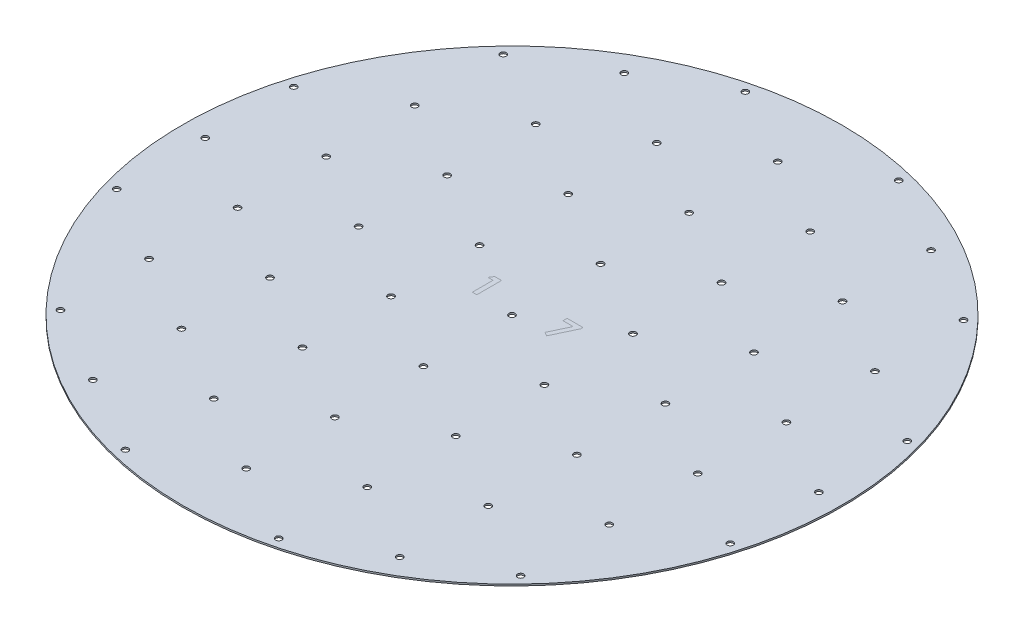
from build123d import *

# Parameters (mm, degrees)
SKETCH2_R                = 40
BOSS_EXTRUDE1_DEPTH      = 0.2
SKETCH4_R                = 0.375
CUT_EXTRUDE2_DEPTH       = 0.2
LPATTERN1_COUNT          = 4
LPATTERN1_PITCH          = 10.75
LPATTERN1_COUNT_DIR2     = 3
LPATTERN1_PITCH_DIR2     = 18.619546181
MIRROR1_COPY_1_SKETCH_R  = 0.375
MIRROR1_COPY_1_DEPTH     = 0.2
MIRROR1_COPY_2_SKETCH_R  = 0.375
MIRROR1_COPY_2_DEPTH     = 0.2
MIRROR1_COPY_3_SKETCH_R  = 0.375
MIRROR1_COPY_3_DEPTH     = 0.2
MIRROR1_COPY_4_SKETCH_R  = 0.375
MIRROR1_COPY_4_DEPTH     = 0.2
MIRROR1_COPY_5_SKETCH_R  = 0.375
MIRROR1_COPY_5_DEPTH     = 0.2
MIRROR1_COPY_6_SKETCH_R  = 0.375
MIRROR1_COPY_6_DEPTH     = 0.2
MIRROR1_COPY_7_SKETCH_R  = 0.375
MIRROR1_COPY_7_DEPTH     = 0.2
MIRROR1_COPY_8_SKETCH_R  = 0.375
MIRROR1_COPY_8_DEPTH     = 0.2
MIRROR1_COPY_9_SKETCH_R  = 0.375
MIRROR1_COPY_9_DEPTH     = 0.2
MIRROR1_COPY_10_SKETCH_R = 0.375
MIRROR1_COPY_10_DEPTH    = 0.2
MIRROR1_COPY_11_SKETCH_R = 0.375
MIRROR1_COPY_11_DEPTH    = 0.2
MIRROR1_COPY_12_SKETCH_R = 0.375
MIRROR1_COPY_12_DEPTH    = 0.2
MIRROR2_COPY_1_SKETCH_R  = 0.375
MIRROR2_COPY_1_DEPTH     = 0.2
MIRROR2_COPY_2_SKETCH_R  = 0.375
MIRROR2_COPY_2_DEPTH     = 0.2
MIRROR2_COPY_3_SKETCH_R  = 0.375
MIRROR2_COPY_3_DEPTH     = 0.2
MIRROR2_COPY_4_SKETCH_R  = 0.375
MIRROR2_COPY_4_DEPTH     = 0.2
MIRROR2_COPY_5_SKETCH_R  = 0.375
MIRROR2_COPY_5_DEPTH     = 0.2
MIRROR2_COPY_6_SKETCH_R  = 0.375
MIRROR2_COPY_6_DEPTH     = 0.2
MIRROR2_COPY_7_SKETCH_R  = 0.375
MIRROR2_COPY_7_DEPTH     = 0.2
MIRROR2_COPY_8_SKETCH_R  = 0.375
MIRROR2_COPY_8_DEPTH     = 0.2
MIRROR2_COPY_9_SKETCH_R  = 0.375
MIRROR2_COPY_9_DEPTH     = 0.2
MIRROR2_COPY_10_SKETCH_R = 0.375
MIRROR2_COPY_10_DEPTH    = 0.2
MIRROR2_COPY_11_SKETCH_R = 0.375
MIRROR2_COPY_11_DEPTH    = 0.2
MIRROR2_COPY_12_SKETCH_R = 0.375
MIRROR2_COPY_12_DEPTH    = 0.2
MIRROR2_COPY_13_SKETCH_R = 0.375
MIRROR2_COPY_13_DEPTH    = 0.2
MIRROR2_COPY_14_SKETCH_R = 0.375
MIRROR2_COPY_14_DEPTH    = 0.2
MIRROR2_COPY_15_SKETCH_R = 0.375
MIRROR2_COPY_15_DEPTH    = 0.2
MIRROR2_COPY_16_SKETCH_R = 0.375
MIRROR2_COPY_16_DEPTH    = 0.2
MIRROR2_COPY_17_SKETCH_R = 0.375
MIRROR2_COPY_17_DEPTH    = 0.2
MIRROR2_COPY_18_SKETCH_R = 0.375
MIRROR2_COPY_18_DEPTH    = 0.2
MIRROR2_COPY_19_SKETCH_R = 0.375
MIRROR2_COPY_19_DEPTH    = 0.2
MIRROR2_COPY_20_SKETCH_R = 0.375
MIRROR2_COPY_20_DEPTH    = 0.2
MIRROR2_COPY_21_SKETCH_R = 0.375
MIRROR2_COPY_21_DEPTH    = 0.2
MIRROR2_COPY_22_SKETCH_R = 0.375
MIRROR2_COPY_22_DEPTH    = 0.2
MIRROR2_COPY_23_SKETCH_R = 0.375
MIRROR2_COPY_23_DEPTH    = 0.2
MIRROR2_COPY_24_SKETCH_R = 0.375
MIRROR2_COPY_24_DEPTH    = 0.2
MIRROR2_COPY_25_SKETCH_R = 0.375
MIRROR2_COPY_25_DEPTH    = 0.2
SPLIT1_SURFACE_1_1_BACK  = 114.137
SPLIT1_SURFACE_1_1_DEPTH = 228.274
SPLIT1_SURFACE_1_2_BACK  = 114.137
SPLIT1_SURFACE_1_2_DEPTH = 228.274
SPLIT1_SURFACE_2_3_BACK  = 114.137
SPLIT1_SURFACE_2_3_DEPTH = 228.274
SPLIT1_SURFACE_2_4_BACK  = 114.137
SPLIT1_SURFACE_2_4_DEPTH = 228.274


with BuildPart() as part:
    # Sketch2 → Boss-Extrude1 (new body)
    with BuildSketch(Plane(origin=(0, 0, 0), x_dir=(1, 0, 0), z_dir=(0, 1, 0))):
        Circle(SKETCH2_R)
    extrude(amount=BOSS_EXTRUDE1_DEPTH)

    # Sketch4 → Cut-Extrude2 (cut)
    with BuildSketch(Plane(origin=(0, 0.2, 0), x_dir=(1, 0, 0), z_dir=(0, 1, 0))):
        with Locations((9.309773091, 5.375)):
            Circle(SKETCH4_R)
        Circle(SKETCH4_R)
    cut_extrude2 = extrude(amount=-CUT_EXTRUDE2_DEPTH, mode=Mode.SUBTRACT)

    # LPattern1: Cut-Extrude2 4 × 3
    with Locations(*[(j * LPATTERN1_PITCH_DIR2, 0, -i * LPATTERN1_PITCH) for i in range(LPATTERN1_COUNT) for j in range(LPATTERN1_COUNT_DIR2) if (i, j) != (0, 0)]):
        add(cut_extrude2, mode=Mode.SUBTRACT)

    # Mirror1 copy 1 sketch → Mirror1 copy 1 (cut)
    with BuildSketch(Plane(origin=(-18.619546181, 0.2, 0), x_dir=(-1, 0, 0), z_dir=(0, 1, 0))):
        with Locations((9.309773091, -5.375)):
            Circle(MIRROR1_COPY_1_SKETCH_R)
        Circle(MIRROR1_COPY_1_SKETCH_R)
    extrude(amount=-MIRROR1_COPY_1_DEPTH, mode=Mode.SUBTRACT)

    # Mirror1 copy 2 sketch → Mirror1 copy 2 (cut)
    with BuildSketch(Plane(origin=(-37.239092363, 0.2, 0), x_dir=(-1, 0, 0), z_dir=(0, 1, 0))):
        with Locations((9.309773091, -5.375)):
            Circle(MIRROR1_COPY_2_SKETCH_R)
        Circle(MIRROR1_COPY_2_SKETCH_R)
    extrude(amount=-MIRROR1_COPY_2_DEPTH, mode=Mode.SUBTRACT)

    # Mirror1 copy 3 sketch → Mirror1 copy 3 (cut)
    with BuildSketch(Plane(origin=(0, 0.2, -10.75), x_dir=(-1, 0, 0), z_dir=(0, 1, 0))):
        with Locations((9.309773091, -5.375)):
            Circle(MIRROR1_COPY_3_SKETCH_R)
        Circle(MIRROR1_COPY_3_SKETCH_R)
    extrude(amount=-MIRROR1_COPY_3_DEPTH, mode=Mode.SUBTRACT)

    # Mirror1 copy 4 sketch → Mirror1 copy 4 (cut)
    with BuildSketch(Plane(origin=(-18.619546181, 0.2, -10.75), x_dir=(-1, 0, 0), z_dir=(0, 1, 0))):
        with Locations((9.309773091, -5.375)):
            Circle(MIRROR1_COPY_4_SKETCH_R)
        Circle(MIRROR1_COPY_4_SKETCH_R)
    extrude(amount=-MIRROR1_COPY_4_DEPTH, mode=Mode.SUBTRACT)

    # Mirror1 copy 5 sketch → Mirror1 copy 5 (cut)
    with BuildSketch(Plane(origin=(-37.239092363, 0.2, -10.75), x_dir=(-1, 0, 0), z_dir=(0, 1, 0))):
        with Locations((9.309773091, -5.375)):
            Circle(MIRROR1_COPY_5_SKETCH_R)
        Circle(MIRROR1_COPY_5_SKETCH_R)
    extrude(amount=-MIRROR1_COPY_5_DEPTH, mode=Mode.SUBTRACT)

    # Mirror1 copy 6 sketch → Mirror1 copy 6 (cut)
    with BuildSketch(Plane(origin=(0, 0.2, -21.5), x_dir=(-1, 0, 0), z_dir=(0, 1, 0))):
        with Locations((9.309773091, -5.375)):
            Circle(MIRROR1_COPY_6_SKETCH_R)
        Circle(MIRROR1_COPY_6_SKETCH_R)
    extrude(amount=-MIRROR1_COPY_6_DEPTH, mode=Mode.SUBTRACT)

    # Mirror1 copy 7 sketch → Mirror1 copy 7 (cut)
    with BuildSketch(Plane(origin=(-18.619546181, 0.2, -21.5), x_dir=(-1, 0, 0), z_dir=(0, 1, 0))):
        with Locations((9.309773091, -5.375)):
            Circle(MIRROR1_COPY_7_SKETCH_R)
        Circle(MIRROR1_COPY_7_SKETCH_R)
    extrude(amount=-MIRROR1_COPY_7_DEPTH, mode=Mode.SUBTRACT)

    # Mirror1 copy 8 sketch → Mirror1 copy 8 (cut)
    with BuildSketch(Plane(origin=(-37.239092363, 0.2, -21.5), x_dir=(-1, 0, 0), z_dir=(0, 1, 0))):
        with Locations((9.309773091, -5.375)):
            Circle(MIRROR1_COPY_8_SKETCH_R)
        Circle(MIRROR1_COPY_8_SKETCH_R)
    extrude(amount=-MIRROR1_COPY_8_DEPTH, mode=Mode.SUBTRACT)

    # Mirror1 copy 9 sketch → Mirror1 copy 9 (cut)
    with BuildSketch(Plane(origin=(0, 0.2, -32.25), x_dir=(-1, 0, 0), z_dir=(0, 1, 0))):
        with Locations((9.309773091, -5.375)):
            Circle(MIRROR1_COPY_9_SKETCH_R)
        Circle(MIRROR1_COPY_9_SKETCH_R)
    extrude(amount=-MIRROR1_COPY_9_DEPTH, mode=Mode.SUBTRACT)

    # Mirror1 copy 10 sketch → Mirror1 copy 10 (cut)
    with BuildSketch(Plane(origin=(-18.619546181, 0.2, -32.25), x_dir=(-1, 0, 0), z_dir=(0, 1, 0))):
        with Locations((9.309773091, -5.375)):
            Circle(MIRROR1_COPY_10_SKETCH_R)
        Circle(MIRROR1_COPY_10_SKETCH_R)
    extrude(amount=-MIRROR1_COPY_10_DEPTH, mode=Mode.SUBTRACT)

    # Mirror1 copy 11 sketch → Mirror1 copy 11 (cut)
    with BuildSketch(Plane(origin=(-37.239092363, 0.2, -32.25), x_dir=(-1, 0, 0), z_dir=(0, 1, 0))):
        with Locations((9.309773091, -5.375)):
            Circle(MIRROR1_COPY_11_SKETCH_R)
        Circle(MIRROR1_COPY_11_SKETCH_R)
    extrude(amount=-MIRROR1_COPY_11_DEPTH, mode=Mode.SUBTRACT)

    # Mirror1 copy 12 sketch → Mirror1 copy 12 (cut)
    with BuildSketch(Plane(origin=(0, 0.2, 0), x_dir=(-1, 0, 0), z_dir=(0, 1, 0))):
        with Locations((9.309773091, -5.375)):
            Circle(MIRROR1_COPY_12_SKETCH_R)
        Circle(MIRROR1_COPY_12_SKETCH_R)
    extrude(amount=-MIRROR1_COPY_12_DEPTH, mode=Mode.SUBTRACT)

    # Mirror2 copy 1 sketch → Mirror2 copy 1 (cut)
    with BuildSketch(Plane(origin=(18.619546181, 0.2, 0), x_dir=(1, 0, 0), z_dir=(0, 1, 0))):
        with Locations((9.309773091, -5.375)):
            Circle(MIRROR2_COPY_1_SKETCH_R)
        Circle(MIRROR2_COPY_1_SKETCH_R)
    extrude(amount=-MIRROR2_COPY_1_DEPTH, mode=Mode.SUBTRACT)

    # Mirror2 copy 2 sketch → Mirror2 copy 2 (cut)
    with BuildSketch(Plane(origin=(37.239092363, 0.2, 0), x_dir=(1, 0, 0), z_dir=(0, 1, 0))):
        with Locations((9.309773091, -5.375)):
            Circle(MIRROR2_COPY_2_SKETCH_R)
        Circle(MIRROR2_COPY_2_SKETCH_R)
    extrude(amount=-MIRROR2_COPY_2_DEPTH, mode=Mode.SUBTRACT)

    # Mirror2 copy 3 sketch → Mirror2 copy 3 (cut)
    with BuildSketch(Plane(origin=(0, 0.2, 10.75), x_dir=(1, 0, 0), z_dir=(0, 1, 0))):
        with Locations((9.309773091, -5.375)):
            Circle(MIRROR2_COPY_3_SKETCH_R)
        Circle(MIRROR2_COPY_3_SKETCH_R)
    extrude(amount=-MIRROR2_COPY_3_DEPTH, mode=Mode.SUBTRACT)

    # Mirror2 copy 4 sketch → Mirror2 copy 4 (cut)
    with BuildSketch(Plane(origin=(18.619546181, 0.2, 10.75), x_dir=(1, 0, 0), z_dir=(0, 1, 0))):
        with Locations((9.309773091, -5.375)):
            Circle(MIRROR2_COPY_4_SKETCH_R)
        Circle(MIRROR2_COPY_4_SKETCH_R)
    extrude(amount=-MIRROR2_COPY_4_DEPTH, mode=Mode.SUBTRACT)

    # Mirror2 copy 5 sketch → Mirror2 copy 5 (cut)
    with BuildSketch(Plane(origin=(37.239092363, 0.2, 10.75), x_dir=(1, 0, 0), z_dir=(0, 1, 0))):
        with Locations((9.309773091, -5.375)):
            Circle(MIRROR2_COPY_5_SKETCH_R)
        Circle(MIRROR2_COPY_5_SKETCH_R)
    extrude(amount=-MIRROR2_COPY_5_DEPTH, mode=Mode.SUBTRACT)

    # Mirror2 copy 6 sketch → Mirror2 copy 6 (cut)
    with BuildSketch(Plane(origin=(0, 0.2, 21.5), x_dir=(1, 0, 0), z_dir=(0, 1, 0))):
        with Locations((9.309773091, -5.375)):
            Circle(MIRROR2_COPY_6_SKETCH_R)
        Circle(MIRROR2_COPY_6_SKETCH_R)
    extrude(amount=-MIRROR2_COPY_6_DEPTH, mode=Mode.SUBTRACT)

    # Mirror2 copy 7 sketch → Mirror2 copy 7 (cut)
    with BuildSketch(Plane(origin=(18.619546181, 0.2, 21.5), x_dir=(1, 0, 0), z_dir=(0, 1, 0))):
        with Locations((9.309773091, -5.375)):
            Circle(MIRROR2_COPY_7_SKETCH_R)
        Circle(MIRROR2_COPY_7_SKETCH_R)
    extrude(amount=-MIRROR2_COPY_7_DEPTH, mode=Mode.SUBTRACT)

    # Mirror2 copy 8 sketch → Mirror2 copy 8 (cut)
    with BuildSketch(Plane(origin=(37.239092363, 0.2, 21.5), x_dir=(1, 0, 0), z_dir=(0, 1, 0))):
        with Locations((9.309773091, -5.375)):
            Circle(MIRROR2_COPY_8_SKETCH_R)
        Circle(MIRROR2_COPY_8_SKETCH_R)
    extrude(amount=-MIRROR2_COPY_8_DEPTH, mode=Mode.SUBTRACT)

    # Mirror2 copy 9 sketch → Mirror2 copy 9 (cut)
    with BuildSketch(Plane(origin=(0, 0.2, 32.25), x_dir=(1, 0, 0), z_dir=(0, 1, 0))):
        with Locations((9.309773091, -5.375)):
            Circle(MIRROR2_COPY_9_SKETCH_R)
        Circle(MIRROR2_COPY_9_SKETCH_R)
    extrude(amount=-MIRROR2_COPY_9_DEPTH, mode=Mode.SUBTRACT)

    # Mirror2 copy 10 sketch → Mirror2 copy 10 (cut)
    with BuildSketch(Plane(origin=(18.619546181, 0.2, 32.25), x_dir=(1, 0, 0), z_dir=(0, 1, 0))):
        with Locations((9.309773091, -5.375)):
            Circle(MIRROR2_COPY_10_SKETCH_R)
        Circle(MIRROR2_COPY_10_SKETCH_R)
    extrude(amount=-MIRROR2_COPY_10_DEPTH, mode=Mode.SUBTRACT)

    # Mirror2 copy 11 sketch → Mirror2 copy 11 (cut)
    with BuildSketch(Plane(origin=(37.239092363, 0.2, 32.25), x_dir=(1, 0, 0), z_dir=(0, 1, 0))):
        with Locations((9.309773091, -5.375)):
            Circle(MIRROR2_COPY_11_SKETCH_R)
        Circle(MIRROR2_COPY_11_SKETCH_R)
    extrude(amount=-MIRROR2_COPY_11_DEPTH, mode=Mode.SUBTRACT)

    # Mirror2 copy 12 sketch → Mirror2 copy 12 (cut)
    with BuildSketch(Plane(origin=(0, 0.2, 0), x_dir=(1, 0, 0), z_dir=(0, 1, 0))):
        with Locations((9.309773091, -5.375)):
            Circle(MIRROR2_COPY_12_SKETCH_R)
        Circle(MIRROR2_COPY_12_SKETCH_R)
    extrude(amount=-MIRROR2_COPY_12_DEPTH, mode=Mode.SUBTRACT)

    # Mirror2 copy 13 sketch → Mirror2 copy 13 (cut)
    with BuildSketch(Plane(origin=(-18.619546181, 0.2, 0), x_dir=(-1, 0, 0), z_dir=(0, 1, 0))):
        with Locations((9.309773091, 5.375)):
            Circle(MIRROR2_COPY_13_SKETCH_R)
        Circle(MIRROR2_COPY_13_SKETCH_R)
    extrude(amount=-MIRROR2_COPY_13_DEPTH, mode=Mode.SUBTRACT)

    # Mirror2 copy 14 sketch → Mirror2 copy 14 (cut)
    with BuildSketch(Plane(origin=(-37.239092363, 0.2, 0), x_dir=(-1, 0, 0), z_dir=(0, 1, 0))):
        with Locations((9.309773091, 5.375)):
            Circle(MIRROR2_COPY_14_SKETCH_R)
        Circle(MIRROR2_COPY_14_SKETCH_R)
    extrude(amount=-MIRROR2_COPY_14_DEPTH, mode=Mode.SUBTRACT)

    # Mirror2 copy 15 sketch → Mirror2 copy 15 (cut)
    with BuildSketch(Plane(origin=(0, 0.2, 10.75), x_dir=(-1, 0, 0), z_dir=(0, 1, 0))):
        with Locations((9.309773091, 5.375)):
            Circle(MIRROR2_COPY_15_SKETCH_R)
        Circle(MIRROR2_COPY_15_SKETCH_R)
    extrude(amount=-MIRROR2_COPY_15_DEPTH, mode=Mode.SUBTRACT)

    # Mirror2 copy 16 sketch → Mirror2 copy 16 (cut)
    with BuildSketch(Plane(origin=(-18.619546181, 0.2, 10.75), x_dir=(-1, 0, 0), z_dir=(0, 1, 0))):
        with Locations((9.309773091, 5.375)):
            Circle(MIRROR2_COPY_16_SKETCH_R)
        Circle(MIRROR2_COPY_16_SKETCH_R)
    extrude(amount=-MIRROR2_COPY_16_DEPTH, mode=Mode.SUBTRACT)

    # Mirror2 copy 17 sketch → Mirror2 copy 17 (cut)
    with BuildSketch(Plane(origin=(-37.239092363, 0.2, 10.75), x_dir=(-1, 0, 0), z_dir=(0, 1, 0))):
        with Locations((9.309773091, 5.375)):
            Circle(MIRROR2_COPY_17_SKETCH_R)
        Circle(MIRROR2_COPY_17_SKETCH_R)
    extrude(amount=-MIRROR2_COPY_17_DEPTH, mode=Mode.SUBTRACT)

    # Mirror2 copy 18 sketch → Mirror2 copy 18 (cut)
    with BuildSketch(Plane(origin=(0, 0.2, 21.5), x_dir=(-1, 0, 0), z_dir=(0, 1, 0))):
        with Locations((9.309773091, 5.375)):
            Circle(MIRROR2_COPY_18_SKETCH_R)
        Circle(MIRROR2_COPY_18_SKETCH_R)
    extrude(amount=-MIRROR2_COPY_18_DEPTH, mode=Mode.SUBTRACT)

    # Mirror2 copy 19 sketch → Mirror2 copy 19 (cut)
    with BuildSketch(Plane(origin=(-18.619546181, 0.2, 21.5), x_dir=(-1, 0, 0), z_dir=(0, 1, 0))):
        with Locations((9.309773091, 5.375)):
            Circle(MIRROR2_COPY_19_SKETCH_R)
        Circle(MIRROR2_COPY_19_SKETCH_R)
    extrude(amount=-MIRROR2_COPY_19_DEPTH, mode=Mode.SUBTRACT)

    # Mirror2 copy 20 sketch → Mirror2 copy 20 (cut)
    with BuildSketch(Plane(origin=(-37.239092363, 0.2, 21.5), x_dir=(-1, 0, 0), z_dir=(0, 1, 0))):
        with Locations((9.309773091, 5.375)):
            Circle(MIRROR2_COPY_20_SKETCH_R)
        Circle(MIRROR2_COPY_20_SKETCH_R)
    extrude(amount=-MIRROR2_COPY_20_DEPTH, mode=Mode.SUBTRACT)

    # Mirror2 copy 21 sketch → Mirror2 copy 21 (cut)
    with BuildSketch(Plane(origin=(0, 0.2, 32.25), x_dir=(-1, 0, 0), z_dir=(0, 1, 0))):
        with Locations((9.309773091, 5.375)):
            Circle(MIRROR2_COPY_21_SKETCH_R)
        Circle(MIRROR2_COPY_21_SKETCH_R)
    extrude(amount=-MIRROR2_COPY_21_DEPTH, mode=Mode.SUBTRACT)

    # Mirror2 copy 22 sketch → Mirror2 copy 22 (cut)
    with BuildSketch(Plane(origin=(-18.619546181, 0.2, 32.25), x_dir=(-1, 0, 0), z_dir=(0, 1, 0))):
        with Locations((9.309773091, 5.375)):
            Circle(MIRROR2_COPY_22_SKETCH_R)
        Circle(MIRROR2_COPY_22_SKETCH_R)
    extrude(amount=-MIRROR2_COPY_22_DEPTH, mode=Mode.SUBTRACT)

    # Mirror2 copy 23 sketch → Mirror2 copy 23 (cut)
    with BuildSketch(Plane(origin=(-37.239092363, 0.2, 32.25), x_dir=(-1, 0, 0), z_dir=(0, 1, 0))):
        with Locations((9.309773091, 5.375)):
            Circle(MIRROR2_COPY_23_SKETCH_R)
        Circle(MIRROR2_COPY_23_SKETCH_R)
    extrude(amount=-MIRROR2_COPY_23_DEPTH, mode=Mode.SUBTRACT)

    # Mirror2 copy 24 sketch → Mirror2 copy 24 (cut)
    with BuildSketch(Plane(origin=(0, 0.2, 0), x_dir=(-1, 0, 0), z_dir=(0, 1, 0))):
        with Locations((9.309773091, 5.375)):
            Circle(MIRROR2_COPY_24_SKETCH_R)
        Circle(MIRROR2_COPY_24_SKETCH_R)
    extrude(amount=-MIRROR2_COPY_24_DEPTH, mode=Mode.SUBTRACT)

    # Mirror2 copy 25 sketch → Mirror2 copy 25 (cut)
    with BuildSketch(Plane(origin=(0, 0.2, 0), x_dir=(1, 0, 0), z_dir=(0, 1, 0))):
        with Locations((9.309773091, -5.375)):
            Circle(MIRROR2_COPY_25_SKETCH_R)
        Circle(MIRROR2_COPY_25_SKETCH_R)
    extrude(amount=-MIRROR2_COPY_25_DEPTH, mode=Mode.SUBTRACT)


with BuildPart() as body_2:
    # Split1: the piece behind the surface
    add(part.part)
    # Split1 surface 1: a surface, the sketch's curves swept straight by 228.274 mm
    with BuildLine(Plane(origin=(0, 0.2, 0), x_dir=(1, 0, 0), z_dir=(0, 1, 0)).offset(-SPLIT1_SURFACE_1_1_BACK), mode=Mode.PRIVATE) as split1_surface_1_1_path:
        Line((-5.423076923, 2.5), (-5.1015625, 3))
        Line((-5.1015625, 3), (-4.269230769, 3))
        Line((-4.269230769, 3), (-4.269230769, 0))
        Line((-4.269230769, 0), (-4.807692308, 0))
        Line((-4.807692308, 0), (-4.807692308, 2.5))
        Line((-4.807692308, 2.5), (-5.423076923, 2.5))
    split1_surface_1_1 = Shell.extrude(split1_surface_1_1_path.wire(), (0 * SPLIT1_SURFACE_1_1_DEPTH, 1 * SPLIT1_SURFACE_1_1_DEPTH, 0 * SPLIT1_SURFACE_1_1_DEPTH))
    split(bisect_by=split1_surface_1_1, keep=Keep.BOTTOM)


with BuildPart() as part_1:
    add(part.part)

    # Split1: split by a surface, the side it looks to stays
    # Split1 surface 1: a surface, the sketch's curves swept straight by 228.274 mm
    with BuildLine(Plane(origin=(0, 0.2, 0), x_dir=(1, 0, 0), z_dir=(0, 1, 0)).offset(-SPLIT1_SURFACE_1_2_BACK), mode=Mode.PRIVATE) as split1_surface_1_2_path:
        Line((-5.423076923, 2.5), (-5.1015625, 3))
        Line((-5.1015625, 3), (-4.269230769, 3))
        Line((-4.269230769, 3), (-4.269230769, 0))
        Line((-4.269230769, 0), (-4.807692308, 0))
        Line((-4.807692308, 0), (-4.807692308, 2.5))
        Line((-4.807692308, 2.5), (-5.423076923, 2.5))
    split1_surface_1_2 = Shell.extrude(split1_surface_1_2_path.wire(), (0 * SPLIT1_SURFACE_1_2_DEPTH, 1 * SPLIT1_SURFACE_1_2_DEPTH, 0 * SPLIT1_SURFACE_1_2_DEPTH))
    split(bisect_by=split1_surface_1_2, keep=Keep.TOP)


with BuildPart() as body_3:
    # Split1 2: the piece behind the surface
    add(part_1.part)
    # Split1 surface 2: a surface, the sketch's curves swept straight by 228.274 mm
    with BuildLine(Plane(origin=(0, 0.2, 0), x_dir=(1, 0, 0), z_dir=(0, 1, 0)).offset(-SPLIT1_SURFACE_2_3_BACK), mode=Mode.PRIVATE) as split1_surface_2_3_path:
        Line((3.692307692, 2.5), (3.692307692, 3))
        Line((3.692307692, 3), (5.615384615, 3))
        Line((5.615384615, 3), (5.615384615, 2.720552885))
        Line((5.615384615, 2.720552885), (4.292067308, -0.076923077))
        Line((4.292067308, -0.076923077), (3.814903846, 0.163461538))
        Line((3.814903846, 0.163461538), (4.920673077, 2.5))
        Line((4.920673077, 2.5), (3.692307692, 2.5))
    split1_surface_2_3 = Shell.extrude(split1_surface_2_3_path.wire(), (0 * SPLIT1_SURFACE_2_3_DEPTH, 1 * SPLIT1_SURFACE_2_3_DEPTH, 0 * SPLIT1_SURFACE_2_3_DEPTH))
    split(bisect_by=split1_surface_2_3, keep=Keep.BOTTOM)


with BuildPart() as part_2:
    add(part_1.part)

    # Split1 2: split by a surface, the side it looks to stays
    # Split1 surface 2: a surface, the sketch's curves swept straight by 228.274 mm
    with BuildLine(Plane(origin=(0, 0.2, 0), x_dir=(1, 0, 0), z_dir=(0, 1, 0)).offset(-SPLIT1_SURFACE_2_4_BACK), mode=Mode.PRIVATE) as split1_surface_2_4_path:
        Line((3.692307692, 2.5), (3.692307692, 3))
        Line((3.692307692, 3), (5.615384615, 3))
        Line((5.615384615, 3), (5.615384615, 2.720552885))
        Line((5.615384615, 2.720552885), (4.292067308, -0.076923077))
        Line((4.292067308, -0.076923077), (3.814903846, 0.163461538))
        Line((3.814903846, 0.163461538), (4.920673077, 2.5))
        Line((4.920673077, 2.5), (3.692307692, 2.5))
    split1_surface_2_4 = Shell.extrude(split1_surface_2_4_path.wire(), (0 * SPLIT1_SURFACE_2_4_DEPTH, 1 * SPLIT1_SURFACE_2_4_DEPTH, 0 * SPLIT1_SURFACE_2_4_DEPTH))
    split(bisect_by=split1_surface_2_4, keep=Keep.TOP)


solid = Compound([body_2.part, body_3.part, part_2.part])
